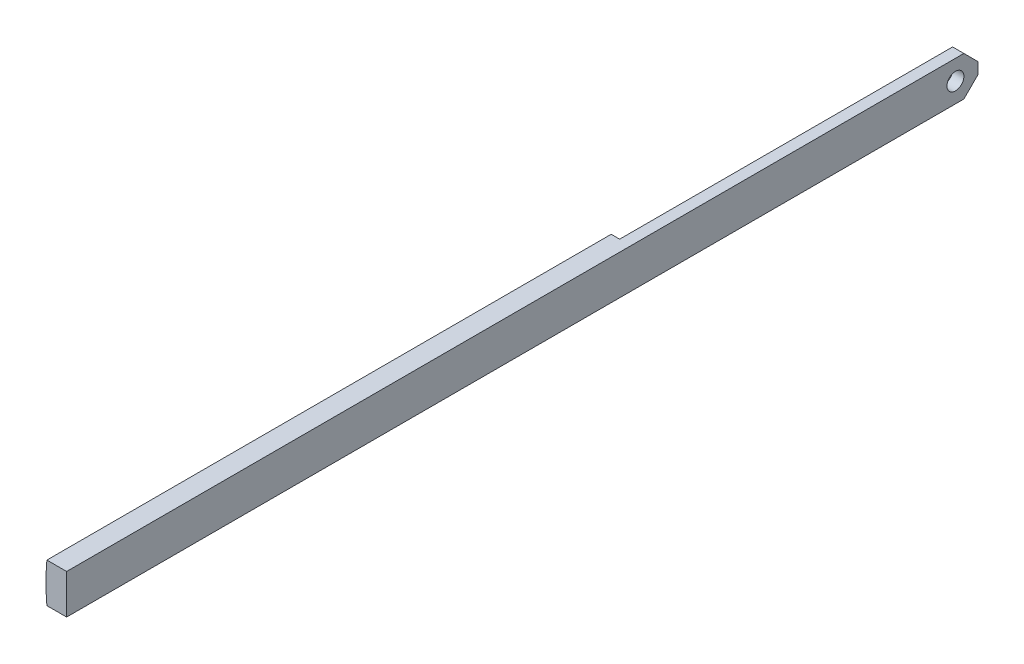
from build123d import *

# Parameters (mm, degrees)
BOSS_EXTRU_1_DEPTH      = 200
ESQUISSE2_W             = 4
ESQUISSE2_H             = 14
BOSS_EXTRU_2_DEPTH      = 123
ESQUISSE3_R             = 3
ENL_V_MAT_EXTRU_1_DEPTH = 201.45907004
CHANFREIN1_SIZE         = 5


with BuildPart() as part:
    # Esquisse1 → Boss.-Extru.1 (new body)
    with BuildSketch(Plane.XY):
        with BuildLine():
            Line((3, 11.393126576), (10, 11.393126576))
            Line((10, 11.393126576), (10, -2.606873424))
            Line((10, -2.606873424), (3, -2.606873424))
            ThreePointArc((3, -2.606873424), (2.649120597, 4.393126576), (3, 11.393126576))
        make_face()
    extrude(amount=BOSS_EXTRU_1_DEPTH)

    # Esquisse2 → Boss.-Extru.2 (add)
    with BuildSketch(Plane(origin=(0, 0, 0), x_dir=(-1, 0, 0), z_dir=(0, 0, -1))):
        with Locations((-8, 4.393126576)):
            Rectangle(ESQUISSE2_W, ESQUISSE2_H)
    extrude(amount=BOSS_EXTRU_2_DEPTH)

    # Esquisse3 → Enlèv. mat.-Extru.1 (cut, through all)
    with BuildSketch(Plane(origin=(10, 0, 0), x_dir=(0, 0, -1), z_dir=(1, 0, 0))):
        with Locations(Location((115, 4.393126576, 0), (0, 0, 90))):
            Circle(ESQUISSE3_R)
    extrude(amount=-ENL_V_MAT_EXTRU_1_DEPTH, mode=Mode.SUBTRACT)

    # Chanfrein1
    chanfrein1_edges = [part.edges().sort_by_distance(p)[0] for p in [
        (8, -2.606873424, -123),
        (8, 11.393126576, -123),
    ]]
    chamfer(chanfrein1_edges, length=CHANFREIN1_SIZE)


solid = part.part
